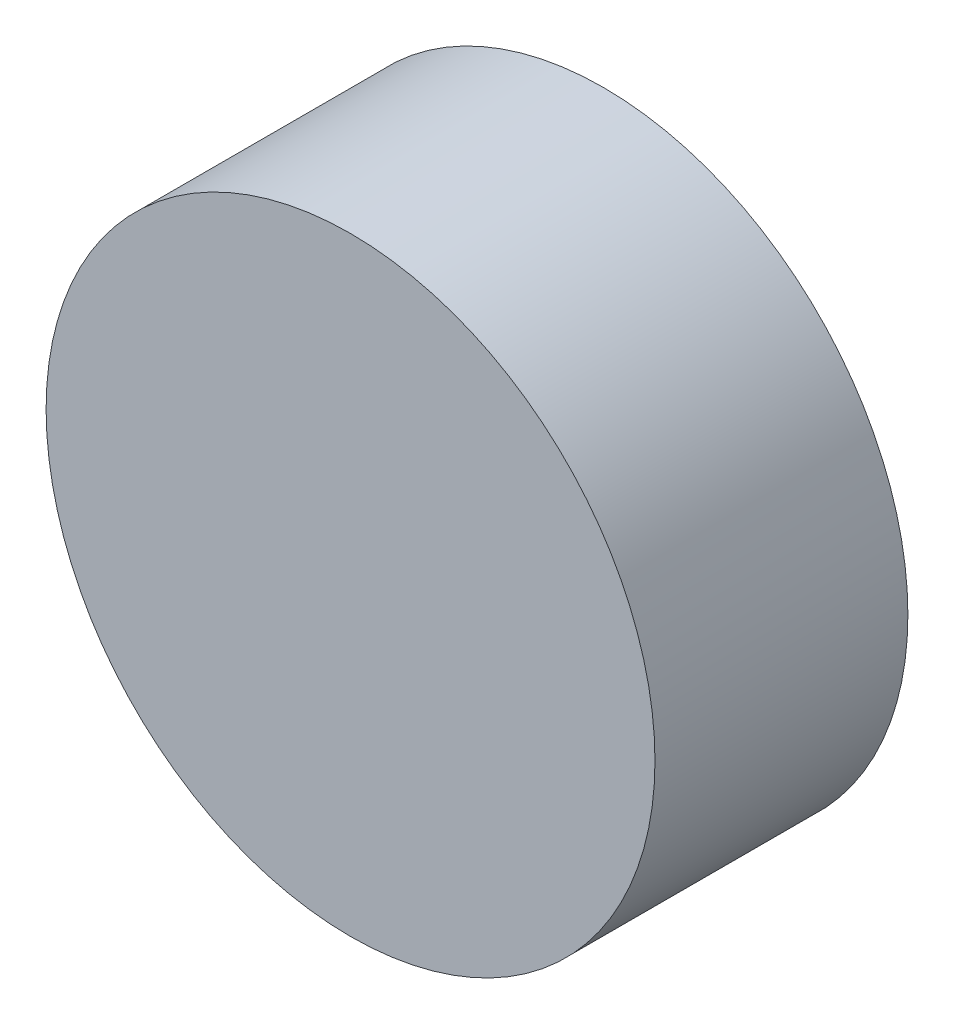
from build123d import *

# Parameters (mm, degrees)
SKETCH_1_R          = 32.5
EXTRUDE_1_DEPTH     = 27
SKETCH_2_R          = 20
CUT_EXTRUDE_1_DEPTH = 10
CUT_EXTRUDE_2_DEPTH = 6


with BuildPart() as part:
    # 草图1 → 凸台-拉伸1 (new body)
    with BuildSketch(Plane.XY):
        Circle(SKETCH_1_R)
    extrude(amount=EXTRUDE_1_DEPTH)

    # 草图2 → 切除-拉伸1 (cut)
    with BuildSketch(Plane(origin=(0, 0, 0), x_dir=(-1, 0, 0), z_dir=(0, 0, -1))):
        Circle(SKETCH_2_R)
    extrude(amount=-CUT_EXTRUDE_1_DEPTH, mode=Mode.SUBTRACT)

    # 草图3 → 切除-拉伸2 (cut)
    with BuildSketch(Plane(origin=(0, 0, 10), x_dir=(-1, 0, 0), z_dir=(0, 0, -1))):
        Polygon((6, 3.464101615), (0, 6.92820323), (-6, 3.464101615), (-6, -3.464101615), (0, -6.92820323), (6, -3.464101615), align=None)
    extrude(amount=-CUT_EXTRUDE_2_DEPTH, mode=Mode.SUBTRACT)


solid = part.part
